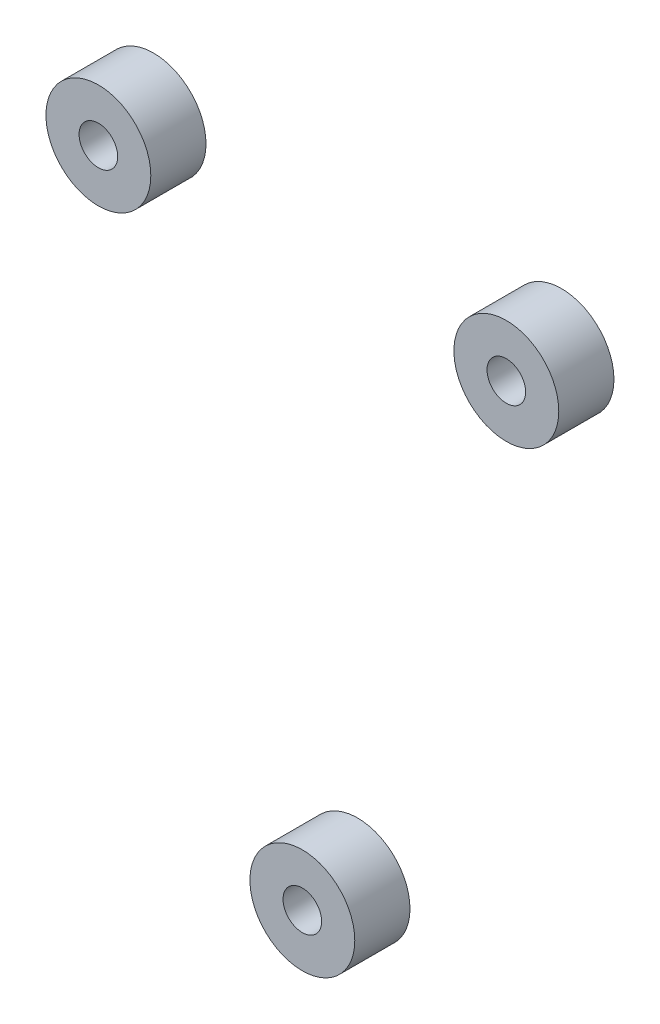
from build123d import *

# Parameters (mm, degrees)
SKETCH1_R                    = 9.5
SKETCH1_R_2                  = 3.5
FOG_LIGHT_SCREWHOLES_DEPTH   = 10
FOG_LIGHT_SCREWHOLES_2_DEPTH = 10
FOG_LIGHT_SCREWHOLES_3_DEPTH = 10


with BuildPart() as part:
    # Sketch1 → Fog light screwholes (new body)
    with BuildSketch(Plane.XY):
        with Locations((-36.960287557, 44.047555479)):
            Circle(SKETCH1_R)
        with Locations((-36.960287557, 44.047555479)):
            Circle(SKETCH1_R_2, mode=Mode.SUBTRACT)
    extrude(amount=FOG_LIGHT_SCREWHOLES_DEPTH)


with BuildPart() as body_2:
    # Sketch1 → Fog light screwholes 2 (new body)
    with BuildSketch(Plane.XY):
        with Locations((36.960287557, 44.047555479)):
            Circle(SKETCH1_R)
        with Locations((36.960287557, 44.047555479)):
            Circle(SKETCH1_R_2, mode=Mode.SUBTRACT)
    extrude(amount=FOG_LIGHT_SCREWHOLES_2_DEPTH)


with BuildPart() as body_3:
    # Sketch1 → Fog light screwholes 3 (new body)
    with BuildSketch(Plane.XY):
        with Locations((0, -57.5)):
            Circle(SKETCH1_R)
        with Locations((0, -57.5)):
            Circle(SKETCH1_R_2, mode=Mode.SUBTRACT)
    extrude(amount=FOG_LIGHT_SCREWHOLES_3_DEPTH)


solid = Compound([part.part, body_2.part, body_3.part])
